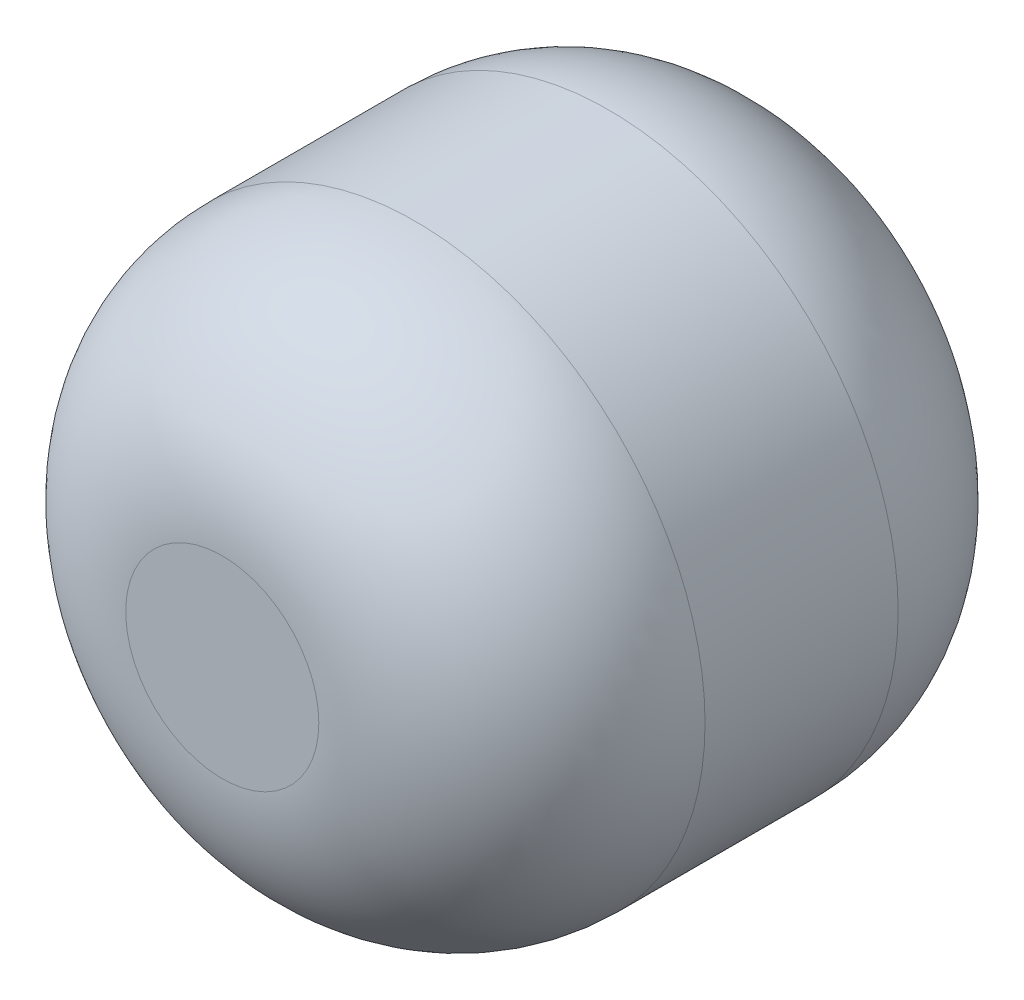
from build123d import *

# Parameters (mm, degrees)
ESQUISSE1_R        = 38.1
BOSS_EXTRU_1_DEPTH = 76.2
CONG_1_R           = 25.4


with BuildPart() as part:
    # Esquisse1 → Boss.-Extru.1 (new body)
    with BuildSketch(Plane.XY):
        with Locations(Location((0, 0, 0), (0, 0, 180))):
            Circle(ESQUISSE1_R)
    extrude(amount=BOSS_EXTRU_1_DEPTH)

    # Congé1
    cong_1_edges = [part.edges().sort_by_distance(p)[0] for p in [
        (38.1, 0, 0),
        (38.1, 0, 76.2),
    ]]
    fillet(cong_1_edges, radius=CONG_1_R)


solid = part.part
